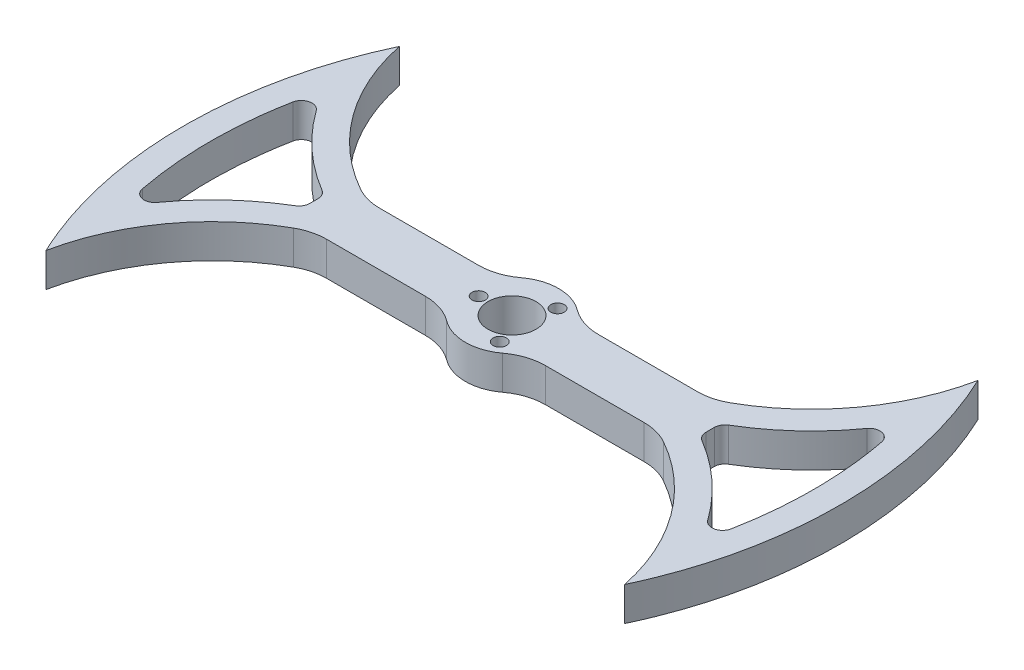
from build123d import *

# Parameters (mm, degrees)
SKETCH1_R           = 8.74
BOSS_EXTRUDE2_DEPTH = 6.35
FILLET1_R           = 10
SKETCH2_R           = 4.5
CUT_EXTRUDE1_DEPTH  = 71.132527363
SKETCH3_R           = 1.25
CUT_EXTRUDE2_DEPTH  = 71.132527363
CUT_EXTRUDE5_DEPTH  = 71.132527363
FILLET2_R           = 2
FILLET3_R           = 2


with BuildPart() as part:
    # Sketch1 → Boss-Extrude2 (new body)
    with BuildSketch(Plane(origin=(0, 0, 0), x_dir=(1, 0, 0), z_dir=(0, 1, 0))):
        with BuildLine():
            ThreePointArc((-7.16851449, -5), (-8.74, 0), (-7.16851449, 5))
            Line((-7.16851449, 5), (-32.16851449, 5))
            ThreePointArc((-32.16851449, 5), (-46.487760751, 16.45991775), (-54.187285312, 33.10587371))
            add(Edge.make_bspline(
                [(-54.187285312, 33.10587371), (-69.799584501, 0), (-54.187285312, -33.10587371)],
                knots=[1.078170572, 1.078170572, 1.078170572, 2.063422082, 2.063422082, 2.063422082], degree=2, weights=[1, 0.88109407, 1]))
            ThreePointArc((-54.187285312, -33.10587371), (-46.487760751, -16.45991775), (-32.16851449, -5))
            Line((-32.16851449, -5), (-7.16851449, -5))
        make_face()
        Circle(SKETCH1_R)
        with BuildLine():
            Line((32.16851449, 5), (7.16851449, 5))
            ThreePointArc((7.16851449, 5), (8.337877927, 2.620570868), (8.74, 0))
            ThreePointArc((8.74, 0), (8.337877927, -2.620570868), (7.16851449, -5))
            Line((7.16851449, -5), (32.16851449, -5))
            ThreePointArc((32.16851449, -5), (46.487760751, -16.45991775), (54.187285312, -33.10587371))
            add(Edge.make_bspline(
                [(54.187285312, -33.10587371), (69.799584501, 0), (54.187285312, 33.10587371)],
                knots=[4.219763225, 4.219763225, 4.219763225, 5.205014735, 5.205014735, 5.205014735], degree=2, weights=[1, 0.88109407, 1]))
            ThreePointArc((54.187285312, 33.10587371), (46.487760751, 16.45991775), (32.16851449, 5))
        make_face()
    extrude(amount=BOSS_EXTRUDE2_DEPTH)

    # Fillet1
    fillet1_edges = [part.edges().sort_by_distance(p)[0] for p in [
        (-32.16851449, 3.175, -5),
        (-7.16851449, 3.175, -5),
        (7.16851449, 3.175, -5),
        (32.16851449, 3.175, -5),
        (32.16851449, 3.175, 5),
        (7.16851449, 3.175, 5),
        (-7.16851449, 3.175, 5),
        (-32.16851449, 3.175, 5),
    ]]
    fillet(fillet1_edges, radius=FILLET1_R)

    # Sketch2 → Cut-Extrude1 (cut, through all)
    with BuildSketch(Plane(origin=(0, 6.35, 0), x_dir=(1, 0, 0), z_dir=(0, 1, 0))):
        with Locations(Location((0, 0, 0), (0, 0, 270))):
            Circle(SKETCH2_R)
    extrude(amount=-CUT_EXTRUDE1_DEPTH, mode=Mode.SUBTRACT)

    # Sketch3 → Cut-Extrude2 (cut, through all)
    with BuildSketch(Plane(origin=(0, 6.35, 0), x_dir=(1, 0, 0), z_dir=(0, 1, 0))):
        with Locations(Location((-6.2464, 0, 0), (0, 0, 270))):
            Circle(SKETCH3_R)
        with Locations(Location((3.1232, 5.409541082, 0), (0, 0, 270))):
            Circle(SKETCH3_R)
        with Locations(Location((3.1232, -5.409541082, 0), (0, 0, 270))):
            Circle(SKETCH3_R)
    extrude(amount=-CUT_EXTRUDE2_DEPTH, mode=Mode.SUBTRACT)

    # Sketch4 → Cut-Extrude5 (cut, through all)
    with BuildSketch(Plane(origin=(0, 6.35, 0), x_dir=(1, 0, 0), z_dir=(0, 1, 0))):
        with BuildLine():
            add(Edge.make_bspline(
                [(-54.07815408, -18.814509315), (-54.878953653, -15.771750191), (-55.485617126, -12.659616872), (-56.296145207, -6.364958437), (-56.5, -3.182494687), (-56.5, 3.182494687), (-56.296145207, 6.364958437), (-55.485617126, 12.659616872), (-54.878953653, 15.771750191), (-54.07815408, 18.814509315)],
                knots=[0, 0, 0, 0, 0.25, 0.25, 0.5, 0.5, 0.75, 0.75, 1, 1, 1, 1], degree=3))
            ThreePointArc((-54.07815408, 18.814509315), (-46.738015221, 9.226749217), (-37.112695661, 1.935932696))
            Line((-37.112695661, 1.935932696), (-37.112695661, -1.935932696))
            ThreePointArc((-37.112695661, -1.935932696), (-46.738015221, -9.226749217), (-54.07815408, -18.814509315))
        make_face()
        with BuildLine():
            ThreePointArc((37.112695661, -1.935932696), (46.738015221, -9.226749217), (54.07815408, -18.814509315))
            add(Edge.make_bspline(
                [(54.07815408, -18.814509315), (54.878953653, -15.771750191), (55.485617126, -12.659616872), (56.296145207, -6.364958437), (56.5, -3.182494687), (56.5, 3.182494687), (56.296145207, 6.364958437), (55.485617126, 12.659616872), (54.878953653, 15.771750191), (54.07815408, 18.814509315)],
                knots=[0, 0, 0, 0, 0.25, 0.25, 0.5, 0.5, 0.75, 0.75, 1, 1, 1, 1], degree=3))
            ThreePointArc((54.07815408, 18.814509315), (46.738015221, 9.226749217), (37.112695661, 1.935932696))
            Line((37.112695661, 1.935932696), (37.112695661, -1.935932696))
        make_face()
    extrude(amount=-CUT_EXTRUDE5_DEPTH, mode=Mode.SUBTRACT)

    # Fillet2
    fillet2_edges = [part.edges().sort_by_distance(p)[0] for p in [
        (-37.112695661, 3.175, 1.935932696),
        (-37.112695661, 3.175, -1.935932696),
        (-54.07815408, 3.175, 18.814509315),
        (-54.07815408, 3.175, -18.814509315),
    ]]
    fillet(fillet2_edges, radius=FILLET2_R)

    # Fillet3
    fillet3_edges = [part.edges().sort_by_distance(p)[0] for p in [
        (54.07815408, 3.175, 18.814509315),
        (54.07815408, 3.175, -18.814509315),
        (37.112695661, 3.175, -1.935932696),
        (37.112695661, 3.175, 1.935932696),
    ]]
    fillet(fillet3_edges, radius=FILLET3_R)


solid = part.part
